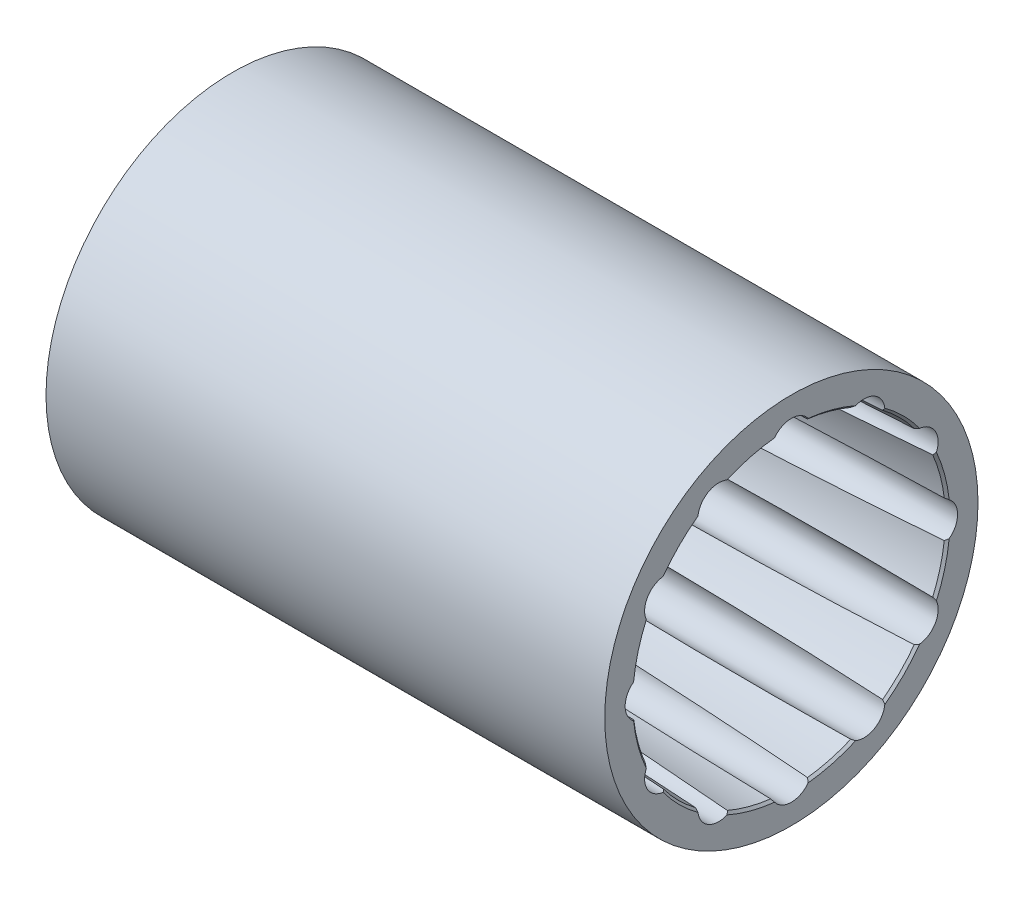
from build123d import *

# Parameters (mm, degrees)
SKETCH1_R              = 21.209
EXTRUDE1_DEPTH         = 63.5
SKETCH2_R              = 17.78
EXTRUDE2_DEPTH         = 25.4
EXTRUDE2_DRAFT         = -2.87
CIRPATTERN1_COUNT      = 12
CHAMFER2_SIZE          = 0.254
CHAMFER2_SIZE2         = 0.267741651
CHAMFER2_EDGE_2_SIZE   = 0.254
CHAMFER2_EDGE_2_SIZE2  = 0.267741651
CHAMFER2_EDGE_3_SIZE   = 0.254
CHAMFER2_EDGE_3_SIZE2  = 0.267741651
CHAMFER2_EDGE_4_SIZE   = 0.254
CHAMFER2_EDGE_4_SIZE2  = 0.267741651
CHAMFER2_EDGE_5_SIZE   = 0.254
CHAMFER2_EDGE_5_SIZE2  = 0.267741651
CHAMFER2_EDGE_6_SIZE   = 0.254
CHAMFER2_EDGE_6_SIZE2  = 0.267741651
CHAMFER2_EDGE_7_SIZE   = 0.254
CHAMFER2_EDGE_7_SIZE2  = 0.267741651
CHAMFER2_EDGE_8_SIZE   = 0.254
CHAMFER2_EDGE_8_SIZE2  = 0.267741651
CHAMFER2_EDGE_9_SIZE   = 0.254
CHAMFER2_EDGE_9_SIZE2  = 0.267741651
CHAMFER2_EDGE_10_SIZE  = 0.254
CHAMFER2_EDGE_10_SIZE2 = 0.267741651
CHAMFER2_EDGE_11_SIZE  = 0.254
CHAMFER2_EDGE_11_SIZE2 = 0.267741651
CHAMFER2_EDGE_12_SIZE  = 0.254
CHAMFER2_EDGE_12_SIZE2 = 0.267741651


with BuildPart() as part:
    # Sketch1 → Extrude1 (new body)
    with BuildSketch(Plane(origin=(0, 0, 0), x_dir=(0, 0, -1), z_dir=(1, 0, 0))):
        Circle(SKETCH1_R)
    extrude(amount=EXTRUDE1_DEPTH)


with BuildPart() as extrude2_tool:
    # Sketch2 → Extrude2 (with draft: the straight prism first)
    with BuildSketch(Plane(origin=(63.5, 0, 0), x_dir=(0, 0, -1), z_dir=(1, 0, 0))):
        Circle(SKETCH2_R)
    extrude(amount=-EXTRUDE2_DEPTH)
    # Extrude2: the draft: its side faces are tilted about the plane it starts from
    extrude2_sides = [extrude2_tool.faces().sort_by_distance(p)[0] for p in [
        (50.8, 0, 17.78),
    ]]
    draft(extrude2_sides, Plane(origin=(63.5, 0, 0), x_dir=(0, 0, -1), z_dir=(1, 0, 0)), EXTRUDE2_DRAFT)


with BuildPart() as part_1:
    add(part.part)

    # Extrude2: cut by extrude2_tool
    add(extrude2_tool.part, mode=Mode.SUBTRACT)

    # Sketch4 → 3/16 (0.1875) Diameter Hole1 (revolve, cut)
    with BuildSketch(Plane(origin=(63.5, 0, 16.51), x_dir=(0, 0, -1), z_dir=(0, 1, 0))):
        Polygon((0, 0), (0, 33.180799349), (2.38125, 31.75), (2.38125, 0), align=None)
    f_3_16_0_1875_diameter_hole1 = revolve(axis=Axis((69.85, 0, 16.51), (-1, 0, 0)), mode=Mode.SUBTRACT)

    # CirPattern1: 3/16 (0.1875) Diameter Hole1 ×12 about axis
    cirpattern1_axis = Axis((0, 0, 0), (1, 0, 0))
    for i in range(1, CIRPATTERN1_COUNT):
        add(f_3_16_0_1875_diameter_hole1.rotate(cirpattern1_axis, i * 360 / CIRPATTERN1_COUNT), mode=Mode.SUBTRACT)

    # Chamfer2
    chamfer2_edges = [part_1.edges().sort_by_distance(p)[0] for p in [
        (63.5, 17.174161191, -4.601802622),
    ]]
    chamfer2_side = [part_1.faces().sort_by_distance(p)[0] for p in [
        (63.5, 0, 20.609118891),
    ]]
    chamfer(chamfer2_edges, length=CHAMFER2_SIZE, length2=CHAMFER2_SIZE2, reference=chamfer2_side[0])

    # Chamfer2 edge 2
    chamfer2_edge_2_edges = [part_1.edges().sort_by_distance(p)[0] for p in [
        (63.5, 12.572358569, -12.572358569),
    ]]
    chamfer2_edge_2_side = [part_1.faces().sort_by_distance(p)[0] for p in [
        (63.5, 0, 20.609118891),
    ]]
    chamfer(chamfer2_edge_2_edges, length=CHAMFER2_EDGE_2_SIZE, length2=CHAMFER2_EDGE_2_SIZE2, reference=chamfer2_edge_2_side[0])

    # Chamfer2 edge 3
    chamfer2_edge_3_edges = [part_1.edges().sort_by_distance(p)[0] for p in [
        (63.5, 4.601802622, -17.174161191),
    ]]
    chamfer2_edge_3_side = [part_1.faces().sort_by_distance(p)[0] for p in [
        (63.5, 0, 20.609118891),
    ]]
    chamfer(chamfer2_edge_3_edges, length=CHAMFER2_EDGE_3_SIZE, length2=CHAMFER2_EDGE_3_SIZE2, reference=chamfer2_edge_3_side[0])

    # Chamfer2 edge 4
    chamfer2_edge_4_edges = [part_1.edges().sort_by_distance(p)[0] for p in [
        (63.5, -4.601802622, -17.174161191),
    ]]
    chamfer2_edge_4_side = [part_1.faces().sort_by_distance(p)[0] for p in [
        (63.5, 0, 20.609118891),
    ]]
    chamfer(chamfer2_edge_4_edges, length=CHAMFER2_EDGE_4_SIZE, length2=CHAMFER2_EDGE_4_SIZE2, reference=chamfer2_edge_4_side[0])

    # Chamfer2 edge 5
    chamfer2_edge_5_edges = [part_1.edges().sort_by_distance(p)[0] for p in [
        (63.5, -12.572358569, -12.572358569),
    ]]
    chamfer2_edge_5_side = [part_1.faces().sort_by_distance(p)[0] for p in [
        (63.5, 0, 20.609118891),
    ]]
    chamfer(chamfer2_edge_5_edges, length=CHAMFER2_EDGE_5_SIZE, length2=CHAMFER2_EDGE_5_SIZE2, reference=chamfer2_edge_5_side[0])

    # Chamfer2 edge 6
    chamfer2_edge_6_edges = [part_1.edges().sort_by_distance(p)[0] for p in [
        (63.5, -17.174161191, -4.601802622),
    ]]
    chamfer2_edge_6_side = [part_1.faces().sort_by_distance(p)[0] for p in [
        (63.5, 0, 20.609118891),
    ]]
    chamfer(chamfer2_edge_6_edges, length=CHAMFER2_EDGE_6_SIZE, length2=CHAMFER2_EDGE_6_SIZE2, reference=chamfer2_edge_6_side[0])

    # Chamfer2 edge 7
    chamfer2_edge_7_edges = [part_1.edges().sort_by_distance(p)[0] for p in [
        (63.5, -17.174161191, 4.601802622),
    ]]
    chamfer2_edge_7_side = [part_1.faces().sort_by_distance(p)[0] for p in [
        (63.5, 0, 20.609118891),
    ]]
    chamfer(chamfer2_edge_7_edges, length=CHAMFER2_EDGE_7_SIZE, length2=CHAMFER2_EDGE_7_SIZE2, reference=chamfer2_edge_7_side[0])

    # Chamfer2 edge 8
    chamfer2_edge_8_edges = [part_1.edges().sort_by_distance(p)[0] for p in [
        (63.5, -12.572358569, 12.572358569),
    ]]
    chamfer2_edge_8_side = [part_1.faces().sort_by_distance(p)[0] for p in [
        (63.5, 0, 20.609118891),
    ]]
    chamfer(chamfer2_edge_8_edges, length=CHAMFER2_EDGE_8_SIZE, length2=CHAMFER2_EDGE_8_SIZE2, reference=chamfer2_edge_8_side[0])

    # Chamfer2 edge 9
    chamfer2_edge_9_edges = [part_1.edges().sort_by_distance(p)[0] for p in [
        (63.5, -4.601802622, 17.174161191),
    ]]
    chamfer2_edge_9_side = [part_1.faces().sort_by_distance(p)[0] for p in [
        (63.5, 0, 20.609118891),
    ]]
    chamfer(chamfer2_edge_9_edges, length=CHAMFER2_EDGE_9_SIZE, length2=CHAMFER2_EDGE_9_SIZE2, reference=chamfer2_edge_9_side[0])

    # Chamfer2 edge 10
    chamfer2_edge_10_edges = [part_1.edges().sort_by_distance(p)[0] for p in [
        (63.5, 4.601802622, 17.174161191),
    ]]
    chamfer2_edge_10_side = [part_1.faces().sort_by_distance(p)[0] for p in [
        (63.5, 0, 20.609118891),
    ]]
    chamfer(chamfer2_edge_10_edges, length=CHAMFER2_EDGE_10_SIZE, length2=CHAMFER2_EDGE_10_SIZE2, reference=chamfer2_edge_10_side[0])

    # Chamfer2 edge 11
    chamfer2_edge_11_edges = [part_1.edges().sort_by_distance(p)[0] for p in [
        (63.5, 12.572358569, 12.572358569),
    ]]
    chamfer2_edge_11_side = [part_1.faces().sort_by_distance(p)[0] for p in [
        (63.5, 0, 20.609118891),
    ]]
    chamfer(chamfer2_edge_11_edges, length=CHAMFER2_EDGE_11_SIZE, length2=CHAMFER2_EDGE_11_SIZE2, reference=chamfer2_edge_11_side[0])

    # Chamfer2 edge 12
    chamfer2_edge_12_edges = [part_1.edges().sort_by_distance(p)[0] for p in [
        (63.5, 17.174161191, 4.601802622),
    ]]
    chamfer2_edge_12_side = [part_1.faces().sort_by_distance(p)[0] for p in [
        (63.5, 0, 20.609118891),
    ]]
    chamfer(chamfer2_edge_12_edges, length=CHAMFER2_EDGE_12_SIZE, length2=CHAMFER2_EDGE_12_SIZE2, reference=chamfer2_edge_12_side[0])


solid = part_1.part
